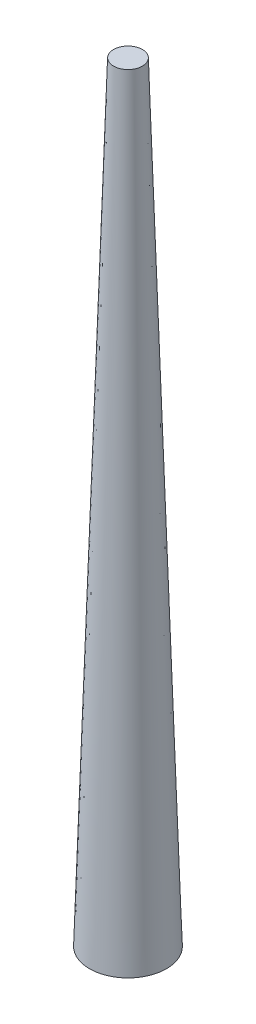
from build123d import *


with BuildPart() as part:
    # Sketch2 → Revolve4 (revolve)
    with BuildSketch(Plane.XY):
        Polygon((0, 0), (-50.8, 0), (-19.05, 1016), (0, 1016), align=None)
    revolve(axis=Axis((0, 1016, 0), (0, -1, 0)))


solid = part.part
